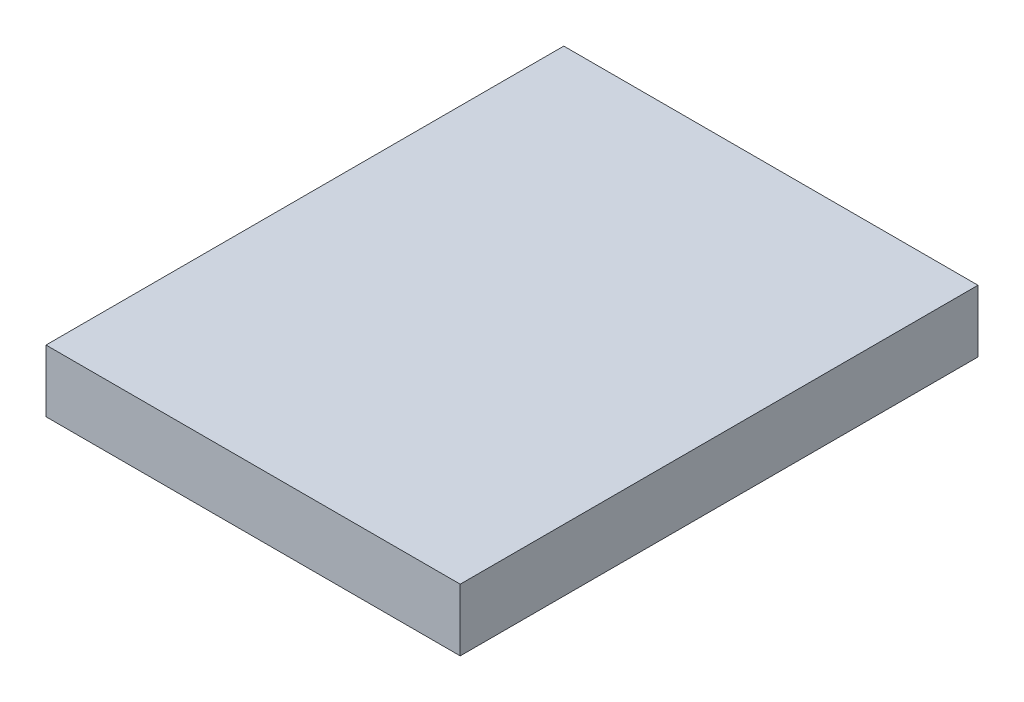
from build123d import *

# Parameters (mm, degrees)
SKETCH1_W           = 20
SKETCH1_H           = 25
BOSS_EXTRUDE1_DEPTH = 3


with BuildPart() as part:
    # Sketch1 → Boss-Extrude1 (new body)
    with BuildSketch(Plane(origin=(0, 0, 0), x_dir=(1, 0, 0), z_dir=(0, 1, 0))):
        Rectangle(SKETCH1_W, SKETCH1_H)
    extrude(amount=BOSS_EXTRUDE1_DEPTH)


solid = part.part
